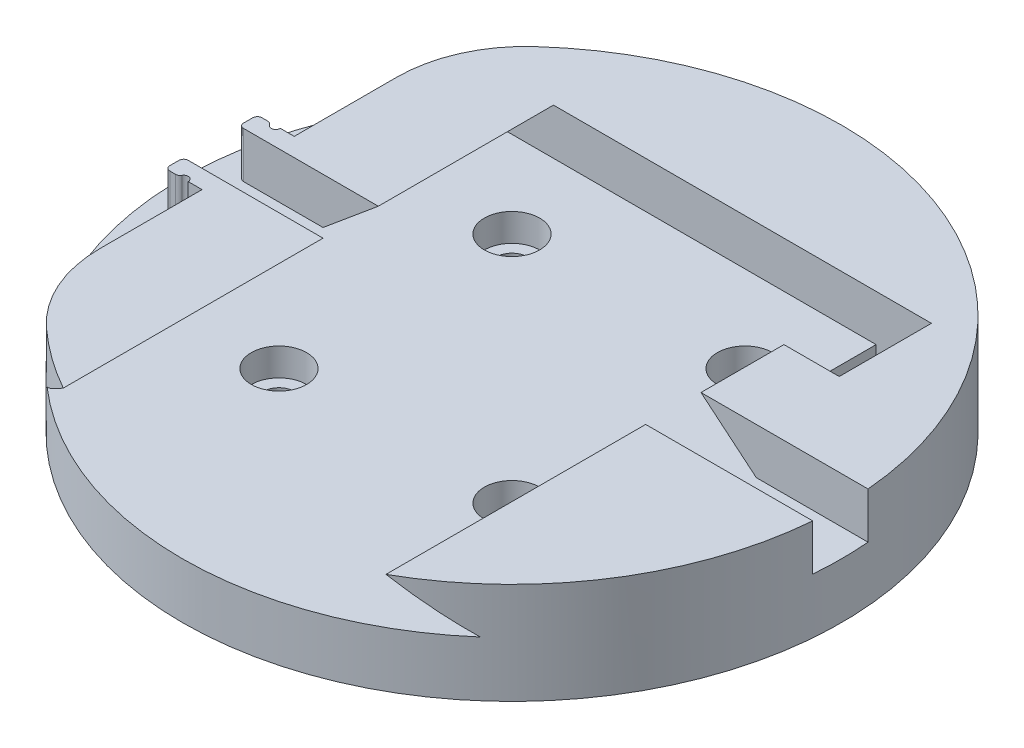
from build123d import *

# Parameters (mm, degrees)
SKETCH1_R                      = 1.7
BOSS_EXTRUDE1_DEPTH            = 11
CUT_EXTRUDE1_START             = -8
SKETCH2_R                      = 3
SKETCH2_R_2                    = 1.7
CUT_EXTRUDE1_DEPTH             = 8
SKETCH3_W                      = 6
SKETCH3_H                      = 10
CUT_EXTRUDE2_DEPTH             = 34
CUT_EXTRUDE3_REACH             = 53.741
SKETCH4_W                      = 35
SKETCH4_H                      = 5
CUT_EXTRUDE3_DIRECTION_2_DEPTH = 44
CUT_EXTRUDE4_DEPTH             = 71.068716272
CUT_EXTRUDE4_DEPTH_BACK        = 71.068716272
CUT_EXTRUDE5_DEPTH             = 5
FILLET3_R                      = 0.5
FILLET4_R                      = 14


with BuildPart() as part:
    # Sketch1 → Boss-Extrude1 (new body)
    # profile 1 of 3: a face of its own
    with BuildSketch(Plane(origin=(0, 0, 0), x_dir=(1, 0, 0), z_dir=(0, 1, 0))):
        with BuildLine():
            Line((35.75, 0), (0, 0))
            Line((0, 0), (0, 35.75))
            ThreePointArc((0, 35.75), (-25.279067427, -25.279067427), (35.75, 0))
        make_face()
        with Locations(Location((-12.639533714, -12.639533714, 0), (0, 0, 270))):
            Circle(SKETCH1_R, mode=Mode.SUBTRACT)
        with Locations(Location((12.639533714, -12.639533714, 0), (0, 0, 270))):
            Circle(SKETCH1_R, mode=Mode.SUBTRACT)
        with Locations(Location((-12.639533714, 12.639533714, 0), (0, 0, 270))):
            Circle(SKETCH1_R, mode=Mode.SUBTRACT)
    # profile 2 of 3: a face of its own
    with BuildSketch(Plane(origin=(0, 0, 0), x_dir=(1, 0, 0), z_dir=(0, 1, 0))):
        with BuildLine():
            Line((0, 35.75), (0, 0))
            Line((0, 0), (11.437452186, 11.437452186))
            ThreePointArc((11.437452186, 11.437452186), (11.437452186, 13.841615242), (13.841615242, 13.841615242))
            Line((13.841615242, 13.841615242), (25.279067427, 25.279067427))
            ThreePointArc((25.279067427, 25.279067427), (13.680932707, 33.028693287), (0, 35.75))
        make_face()
    # profile 3 of 3: a face of its own
    with BuildSketch(Plane(origin=(0, 0, 0), x_dir=(1, 0, 0), z_dir=(0, 1, 0))):
        with BuildLine():
            Line((11.437452186, 11.437452186), (0, 0))
            Line((0, 0), (35.75, 0))
            ThreePointArc((35.75, 0), (33.028693287, 13.680932707), (25.279067427, 25.279067427))
            Line((25.279067427, 25.279067427), (13.841615242, 13.841615242))
            ThreePointArc((13.841615242, 13.841615242), (14.210128919, 13.290095549), (14.339533714, 12.639533714))
            ThreePointArc((14.339533714, 12.639533714), (13.290095549, 11.068938508), (11.437452186, 11.437452186))
        make_face()
    extrude(amount=BOSS_EXTRUDE1_DEPTH)

    # Sketch2 → Cut-Extrude1 (cut)
    # profile 1 of 4: a face of its own
    with BuildSketch(Plane(origin=(0, 11, 0), x_dir=(1, 0, 0), z_dir=(0, 1, 0)).offset(CUT_EXTRUDE1_START)):
        with Locations(Location((-12.639533714, -12.639533714, 0), (0, 0, 270))):
            Circle(SKETCH2_R)
        with Locations(Location((-12.639533714, -12.639533714, 0), (0, 0, 270))):
            Circle(SKETCH2_R_2, mode=Mode.SUBTRACT)
    # profile 2 of 4: a face of its own
    with BuildSketch(Plane(origin=(0, 11, 0), x_dir=(1, 0, 0), z_dir=(0, 1, 0)).offset(CUT_EXTRUDE1_START)):
        with Locations(Location((12.639533714, -12.639533714, 0), (0, 0, 270))):
            Circle(SKETCH2_R)
        with Locations(Location((12.639533714, -12.639533714, 0), (0, 0, 270))):
            Circle(SKETCH2_R_2, mode=Mode.SUBTRACT)
    # profile 3 of 4: a face of its own
    with BuildSketch(Plane(origin=(0, 11, 0), x_dir=(1, 0, 0), z_dir=(0, 1, 0)).offset(CUT_EXTRUDE1_START)):
        with Locations(Location((12.639533714, 12.639533714, 0), (0, 0, 270))):
            Circle(SKETCH2_R)
        with Locations(Location((12.639533714, 12.639533714, 0), (0, 0, 270))):
            Circle(SKETCH2_R_2, mode=Mode.SUBTRACT)
    # profile 4 of 4: a face of its own
    with BuildSketch(Plane(origin=(0, 11, 0), x_dir=(1, 0, 0), z_dir=(0, 1, 0)).offset(CUT_EXTRUDE1_START)):
        with Locations(Location((-12.639533714, 12.639533714, 0), (0, 0, 270))):
            Circle(SKETCH2_R)
        with Locations(Location((-12.639533714, 12.639533714, 0), (0, 0, 270))):
            Circle(SKETCH2_R_2, mode=Mode.SUBTRACT)
    extrude(amount=CUT_EXTRUDE1_DEPTH, mode=Mode.SUBTRACT)

    # Sketch3 → Cut-Extrude2 (cut)
    with BuildSketch(Plane(origin=(0, 11, 0), x_dir=(1, 0, 0), z_dir=(0, 1, 0))):
        with Locations((20.5, 17)):
            Rectangle(SKETCH3_W, SKETCH3_H)
    extrude(amount=-CUT_EXTRUDE2_DEPTH, mode=Mode.SUBTRACT)

    # Cut-Extrude3: up to this face of the body (flat: up to its plane)
    cut_extrude3_end = Plane(part.part.faces().sort_by_distance((20.5, 5.5, -22))[0])
    # Sketch4 → Cut-Extrude3 (cut, up to the picked face)
    with BuildSketch(Plane.XY, mode=Mode.PRIVATE) as cut_extrude3_sk1:
        with Locations((0, 8.5)):
            Rectangle(SKETCH4_W, SKETCH4_H)
    cut_extrude3_tool1 = split(extrude(cut_extrude3_sk1.sketch, amount=-CUT_EXTRUDE3_REACH, mode=Mode.PRIVATE), bisect_by=cut_extrude3_end, keep=Keep.BOTH, mode=Mode.PRIVATE)
    # Sketch4 → Cut-Extrude3 (cut, up to the picked face)
    with BuildSketch(Plane.XY, mode=Mode.PRIVATE) as cut_extrude3_sk2:
        Polygon((-17.5, 6), (-17.5, 11), (-23.5, 6), align=None)
    cut_extrude3_tool2 = split(extrude(cut_extrude3_sk2.sketch, amount=-CUT_EXTRUDE3_REACH, mode=Mode.PRIVATE), bisect_by=cut_extrude3_end, keep=Keep.BOTH, mode=Mode.PRIVATE)
    # Sketch4 → Cut-Extrude3 (cut, up to the picked face)
    with BuildSketch(Plane.XY, mode=Mode.PRIVATE) as cut_extrude3_sk3:
        Polygon((23.5, 6), (17.5, 6), (17.5, 11), align=None)
    cut_extrude3_tool3 = split(extrude(cut_extrude3_sk3.sketch, amount=-CUT_EXTRUDE3_REACH, mode=Mode.PRIVATE), bisect_by=cut_extrude3_end, keep=Keep.BOTH, mode=Mode.PRIVATE)
    add(cut_extrude3_tool1.solids().sort_by(Axis((0, 8.5, 0), (0, 0, -1)))[0], mode=Mode.SUBTRACT)
    add(cut_extrude3_tool2.solids().sort_by(Axis((-19.5, 7.666667, 0), (0, 0, -1)))[0], mode=Mode.SUBTRACT)
    add(cut_extrude3_tool3.solids().sort_by(Axis((19.5, 7.666667, 0), (0, 0, -1)))[0], mode=Mode.SUBTRACT)

    # Sketch4 → Cut-Extrude3 direction 2 (cut)
    with BuildSketch(Plane.XY):
        with Locations((0, 8.5)):
            Rectangle(SKETCH4_W, SKETCH4_H)
        Polygon((-17.5, 6), (-17.5, 11), (-23.5, 6), align=None)
        Polygon((23.5, 6), (17.5, 6), (17.5, 11), align=None)
    extrude(amount=CUT_EXTRUDE3_DIRECTION_2_DEPTH, mode=Mode.SUBTRACT)

    # Sketch5 → Cut-Extrude4 (cut, two sides: drawn at the far end of the back side and taken through both)
    with BuildSketch(Plane.ZY.offset(-23.5).offset(-CUT_EXTRUDE4_DEPTH_BACK)):
        Polygon((-3, 11), (-3, 6), (0, 6), (3, 6), (3, 11), align=None)
    extrude(amount=CUT_EXTRUDE4_DEPTH + CUT_EXTRUDE4_DEPTH_BACK, mode=Mode.SUBTRACT)

    # Sketch6 → Cut-Extrude5 (cut)
    with BuildSketch(Plane(origin=(0, 11, 0), x_dir=(1, 0, 0), z_dir=(0, 1, 0))):
        Polygon((-35.623903492, 21.174718123), (-35.623903492, 3), (-32.623903492, 3), (-32.623903492, 5), (-32.623903492, 21.174718123), align=None)
        with BuildLine():
            Line((-35.623903492, 31.403345095), (-35.623903492, 21.174718123))
            Line((-35.623903492, 21.174718123), (-32.623903492, 21.174718123))
            Line((-32.623903492, 21.174718123), (-32.623903492, 5))
            Line((-32.623903492, 5), (-31.123903492, 5))
            ThreePointArc((-31.123903492, 5), (-30.623903492, 5.5), (-30.123903492, 5))
            Line((-30.123903492, 5), (-28.623903492, 5))
            Line((-28.623903492, 5), (-28.623903492, 18.959009746))
            Line((-28.623903492, 18.959009746), (-28.623903492, 31.403345095))
            Line((-28.623903492, 31.403345095), (-35.623903492, 31.403345095))
        make_face()
        with BuildLine():
            ThreePointArc((-30.123903492, 5), (-30.623903492, 5.5), (-31.123903492, 5))
            Line((-31.123903492, 5), (-30.123903492, 5))
        make_face()
        with BuildLine():
            Line((-30.123903492, 5), (-31.123903492, 5))
            ThreePointArc((-31.123903492, 5), (-30.623903492, 4.5), (-30.123903492, 5))
        make_face()
        with BuildLine():
            Line((-32.623903492, -5), (-32.623903492, -21.174718123))
            Line((-32.623903492, -21.174718123), (-35.623903492, -21.174718123))
            Line((-35.623903492, -21.174718123), (-35.623903492, -31.403345095))
            Line((-35.623903492, -31.403345095), (-28.623903492, -31.403345095))
            Line((-28.623903492, -31.403345095), (-28.623903492, -5))
            Line((-28.623903492, -5), (-30.123903492, -5))
            ThreePointArc((-30.123903492, -5), (-30.623903492, -5.5), (-31.123903492, -5))
            Line((-31.123903492, -5), (-32.623903492, -5))
        make_face()
        Polygon((-35.623903492, -21.174718123), (-32.623903492, -21.174718123), (-32.623903492, -5), (-32.623903492, -3), (-35.623903492, -3), align=None)
        with BuildLine():
            ThreePointArc((-30.123903492, -5), (-30.623903492, -4.5), (-31.123903492, -5))
            Line((-31.123903492, -5), (-30.123903492, -5))
        make_face()
        with BuildLine():
            Line((-30.123903492, -5), (-31.123903492, -5))
            ThreePointArc((-31.123903492, -5), (-30.623903492, -5.5), (-30.123903492, -5))
        make_face()
    extrude(amount=-CUT_EXTRUDE5_DEPTH, mode=Mode.SUBTRACT)

    # Fillet3
    fillet3_edges = [part.edges().sort_by_distance(p)[0] for p in [
        (-31.123903492, 8.5, -5),
        (-32.623903492, 8.5, -5),
        (-32.623903492, 8.5, -3),
        (-31.123903492, 8.5, 5),
        (-32.623903492, 8.5, 5),
        (-32.623903492, 8.5, 3),
    ]]
    fillet(fillet3_edges, radius=FILLET3_R)

    # Fillet4
    fillet4_edges = [part.edges().sort_by_distance(p)[0] for p in [
        (-28.623903492, 8.5, -21.418091626),
        (-28.623903492, 8.5, 21.418091626),
    ]]
    fillet(fillet4_edges, radius=FILLET4_R)


solid = part.part
